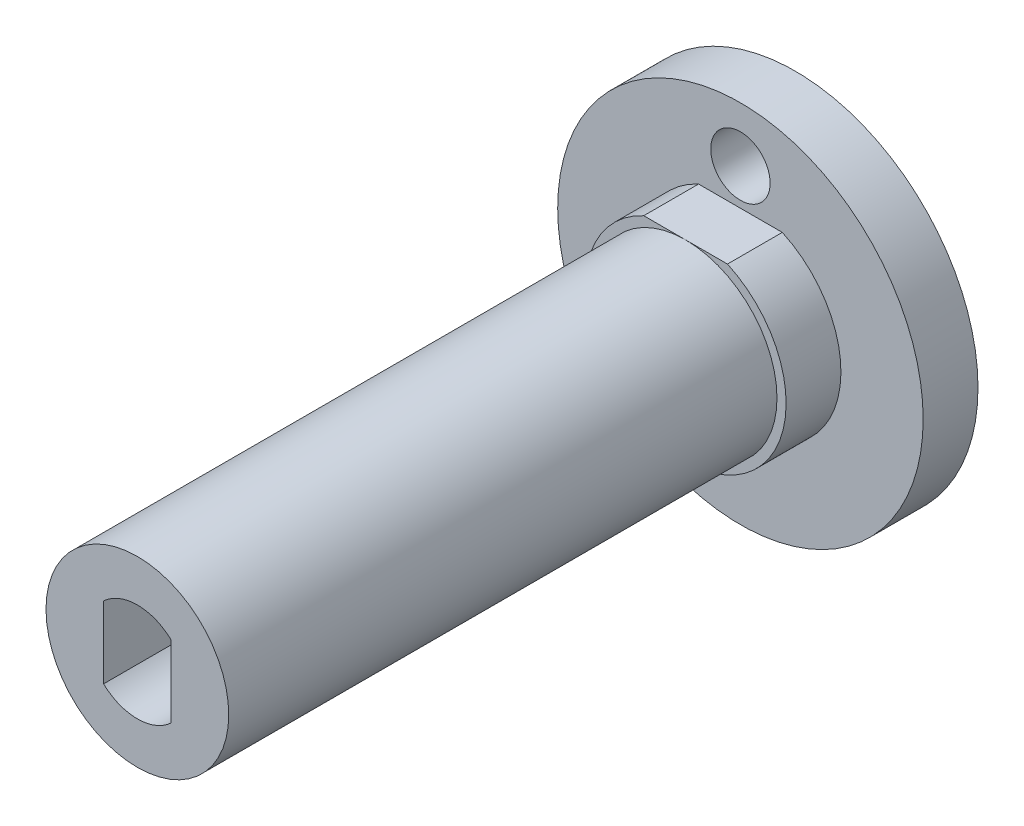
from build123d import *

# Parameters (mm, degrees)
SKETCH1_R           = 10
SKETCH1_R_2         = 1.625
BOSS_EXTRUDE1_DEPTH = 3
BOSS_EXTRUDE2_DEPTH = 3
SKETCH3_R           = 5
BOSS_EXTRUDE3_DEPTH = 30
CUT_EXTRUDE1_DEPTH  = 8


with BuildPart() as part:
    # Sketch1 → Boss-Extrude1 (new body)
    with BuildSketch(Plane.XY):
        Circle(SKETCH1_R)
        with Locations((0, 7)):
            Circle(SKETCH1_R_2, mode=Mode.SUBTRACT)
    extrude(amount=BOSS_EXTRUDE1_DEPTH)

    # Sketch2 → Boss-Extrude2 (add)
    with BuildSketch(Plane.XY.offset(3)):
        with BuildLine():
            Line((-2.291287847, 5), (2.291287847, 5))
            ThreePointArc((2.291287847, 5), (0, -5.5), (-2.291287847, 5))
        make_face()
    extrude(amount=BOSS_EXTRUDE2_DEPTH)

    # Sketch3 → Boss-Extrude3 (add)
    with BuildSketch(Plane.XY.offset(6)):
        with Locations(Location((0, 0, 0), (0, 0, 90))):
            Circle(SKETCH3_R)
    extrude(amount=BOSS_EXTRUDE3_DEPTH)

    # Sketch4 → Cut-Extrude1 (cut)
    with BuildSketch(Plane.XY.offset(36)):
        with BuildLine():
            Line((1.85, -1.966596044), (1.85, 1.966596044))
            ThreePointArc((1.85, 1.966596044), (0, 2.7), (-1.85, 1.966596044))
            Line((-1.85, 1.966596044), (-1.85, -1.966596044))
            ThreePointArc((-1.85, -1.966596044), (0, -2.7), (1.85, -1.966596044))
        make_face()
    extrude(amount=-CUT_EXTRUDE1_DEPTH, mode=Mode.SUBTRACT)


solid = part.part
